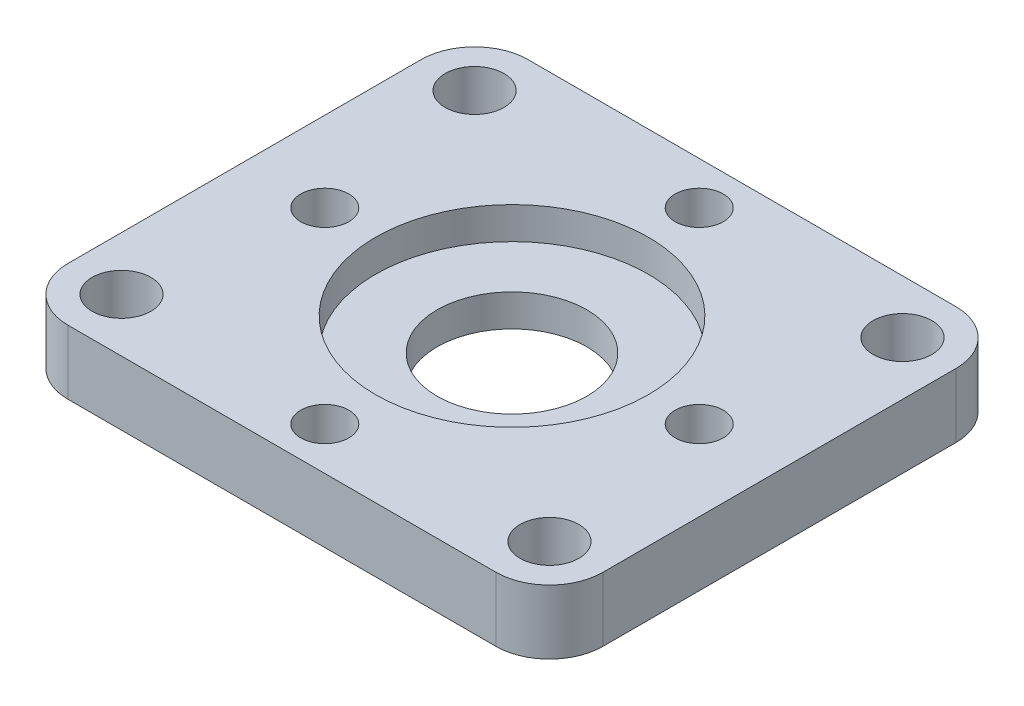
from build123d import *

# Parameters (mm, degrees)
SKETCH1_W           = 50
SKETCH1_H           = 43
SKETCH1_R           = 2.75
BOSS_EXTRUDE1_DEPTH = 6
SKETCH2_R           = 7
CUT_EXTRUDE1_DEPTH  = 6
SKETCH3_R           = 2.25
CUT_EXTRUDE2_DEPTH  = 6
SKETCH4_R           = 12.75
CUT_EXTRUDE3_DEPTH  = 3
FILLET1_R           = 5


with BuildPart() as part:
    # Sketch1 → Boss-Extrude1 (new body)
    with BuildSketch(Plane(origin=(0, 0, 0), x_dir=(1, 0, 0), z_dir=(0, 1, 0))):
        Rectangle(SKETCH1_W, SKETCH1_H)
        with Locations(Location((-20, 16.5, 0), (0, 0, 270))):
            Circle(SKETCH1_R, mode=Mode.SUBTRACT)
        with Locations(Location((20, 16.5, 0), (0, 0, 270))):
            Circle(SKETCH1_R, mode=Mode.SUBTRACT)
        with Locations(Location((-20, -16.5, 0), (0, 0, 270))):
            Circle(SKETCH1_R, mode=Mode.SUBTRACT)
        with Locations(Location((20, -16.5, 0), (0, 0, 270))):
            Circle(SKETCH1_R, mode=Mode.SUBTRACT)
    extrude(amount=BOSS_EXTRUDE1_DEPTH)

    # Sketch2 → Cut-Extrude1 (cut)
    with BuildSketch(Plane(origin=(0, 6, 0), x_dir=(1, 0, 0), z_dir=(0, 1, 0))):
        with Locations(Location((0, 0, 0), (0, 0, 270))):
            Circle(SKETCH2_R)
    extrude(amount=-CUT_EXTRUDE1_DEPTH, mode=Mode.SUBTRACT)

    # Sketch3 → Cut-Extrude2 (cut)
    with BuildSketch(Plane(origin=(0, 6, 0), x_dir=(1, 0, 0), z_dir=(0, 1, 0))):
        with Locations(Location((0, 17.5, 0), (0, 0, 270))):
            Circle(SKETCH3_R)
        with Locations(Location((17.5, 0, 0), (0, 0, 270))):
            Circle(SKETCH3_R)
        with Locations(Location((0, -17.5, 0), (0, 0, 270))):
            Circle(SKETCH3_R)
        with Locations(Location((-17.5, 0, 0), (0, 0, 270))):
            Circle(SKETCH3_R)
    extrude(amount=-CUT_EXTRUDE2_DEPTH, mode=Mode.SUBTRACT)

    # Sketch4 → Cut-Extrude3 (cut)
    with BuildSketch(Plane(origin=(0, 6, 0), x_dir=(1, 0, 0), z_dir=(0, 1, 0))):
        with Locations(Location((0, 0, 0), (0, 0, 270))):
            Circle(SKETCH4_R)
    extrude(amount=-CUT_EXTRUDE3_DEPTH, mode=Mode.SUBTRACT)

    # Fillet1
    fillet1_edges = [part.edges().sort_by_distance(p)[0] for p in [
        (-25, 3, -21.5),
        (25, 3, -21.5),
        (25, 3, 21.5),
        (-25, 3, 21.5),
    ]]
    fillet(fillet1_edges, radius=FILLET1_R)


solid = part.part
